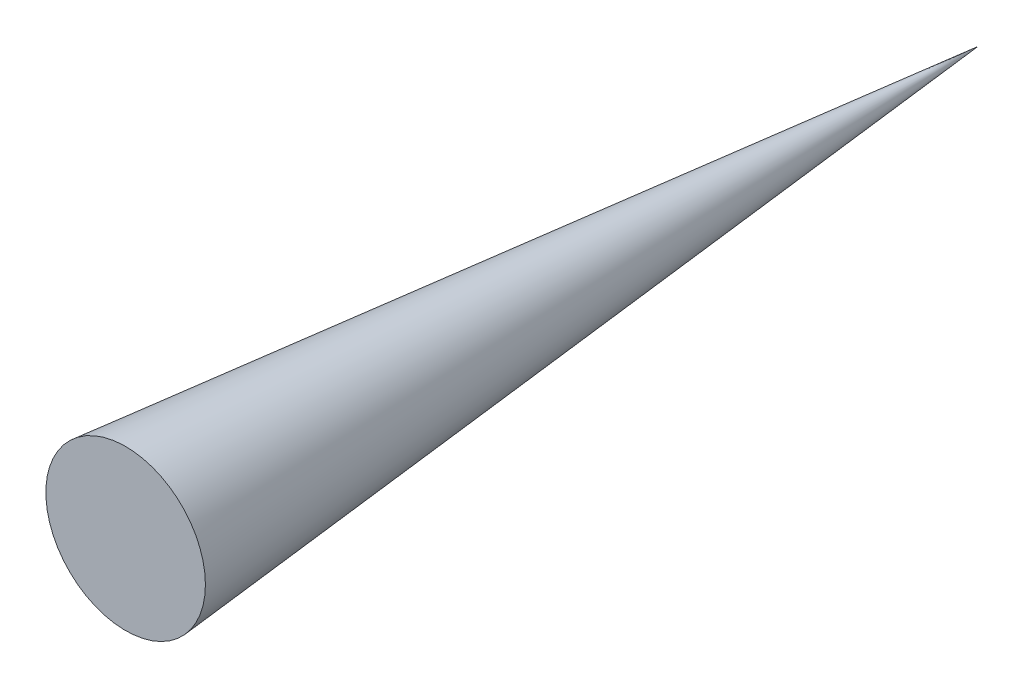
from build123d import *


with BuildPart() as part:
    # Sketch1 → Revolve1 (revolve)
    with BuildSketch(Plane(origin=(0, 0, 0), x_dir=(1, 0, 0), z_dir=(0, 1, 0)), mode=Mode.PRIVATE) as revolve1_sk:
        Polygon((0, 0), (-30, 0), (0, 320.5), align=None)
    revolve(revolve1_sk.sketch.rotate(Axis((0, 0, 33.992998997), (0, 0, -1)), 180), axis=Axis((0, 0, 33.992998997), (0, 0, -1)))


solid = part.part
